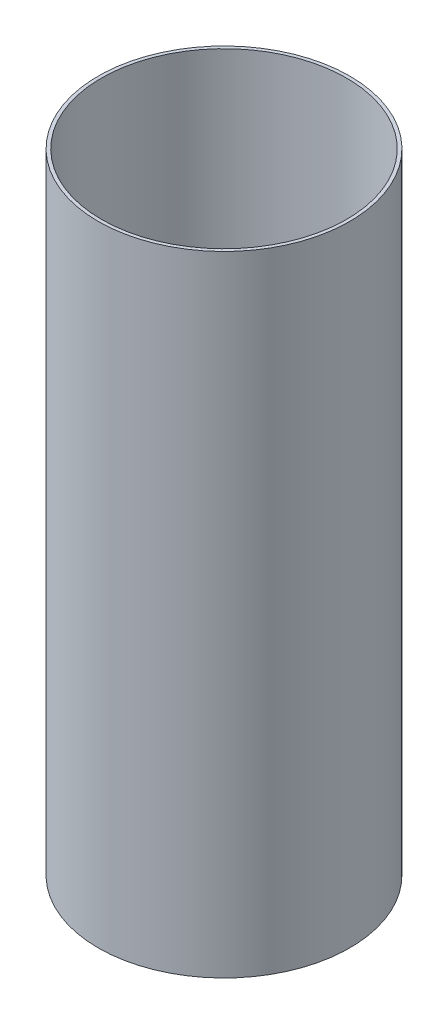
from build123d import *

# Parameters (mm, degrees)
SKETCH1_R           = 76.2
SKETCH1_R_2         = 74.2
BOSS_EXTRUDE1_DEPTH = 381


with BuildPart() as part:
    # Sketch1 → Boss-Extrude1 (new body)
    with BuildSketch(Plane(origin=(0, 0, 0), x_dir=(1, 0, 0), z_dir=(0, 1, 0))):
        with Locations(Location((0, 0, 0), (0, 0, 270))):
            Circle(SKETCH1_R)
        with Locations(Location((0, 0, 0), (0, 0, 270))):
            Circle(SKETCH1_R_2, mode=Mode.SUBTRACT)
    extrude(amount=BOSS_EXTRUDE1_DEPTH)


solid = part.part
